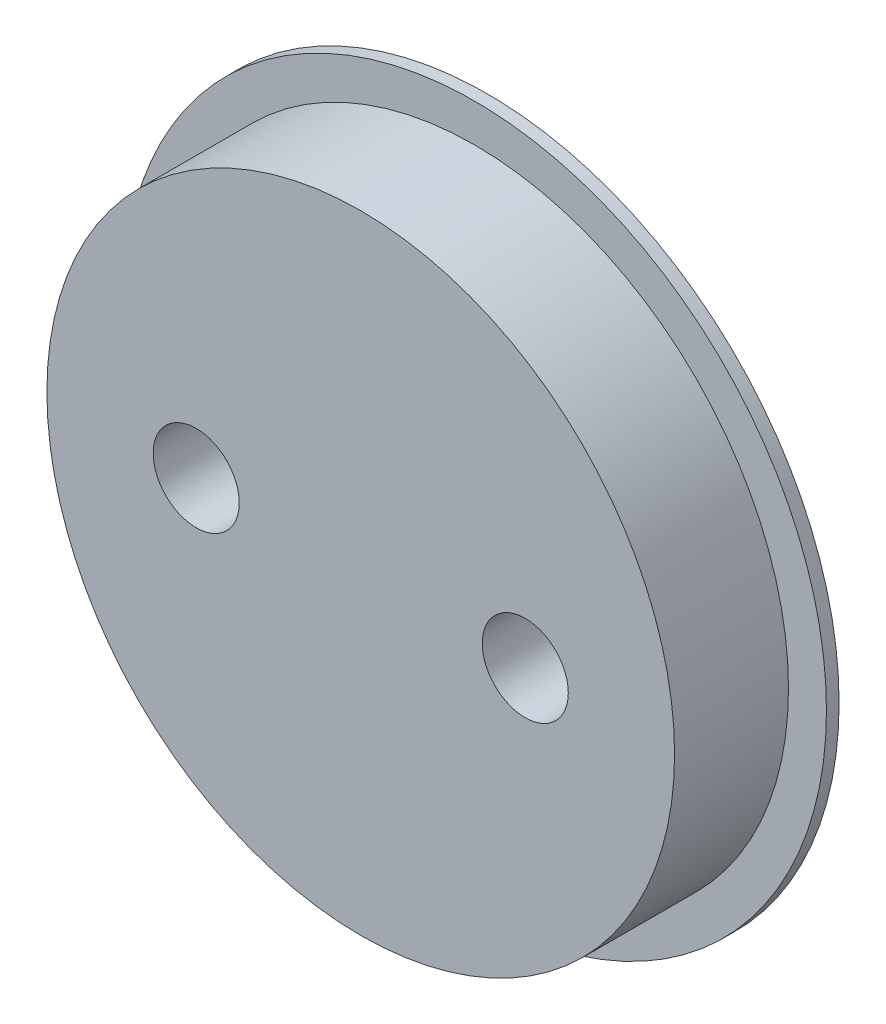
from build123d import *

# Parameters (mm, degrees)
SKETCH_1_R      = 12.4
SKETCH_1_R_2    = 1.7
EXTRUDE_1_DEPTH = 5
SKETCH_2_R      = 13.9
SKETCH_2_R_2    = 12.4
EXTRUDE_2_DEPTH = 0.5


with BuildPart() as part:
    # 草图1 → 凸台-拉伸1 (new body)
    with BuildSketch(Plane.XY):
        Circle(SKETCH_1_R)
        with Locations((-6.5, 0)):
            Circle(SKETCH_1_R_2, mode=Mode.SUBTRACT)
        with Locations((6.5, 0)):
            Circle(SKETCH_1_R_2, mode=Mode.SUBTRACT)
    extrude(amount=EXTRUDE_1_DEPTH)

    # 草图2 → 凸台-拉伸2 (add)
    with BuildSketch(Plane.XY):
        Circle(SKETCH_2_R)
        Circle(SKETCH_2_R_2, mode=Mode.SUBTRACT)
    extrude(amount=EXTRUDE_2_DEPTH)


solid = part.part
